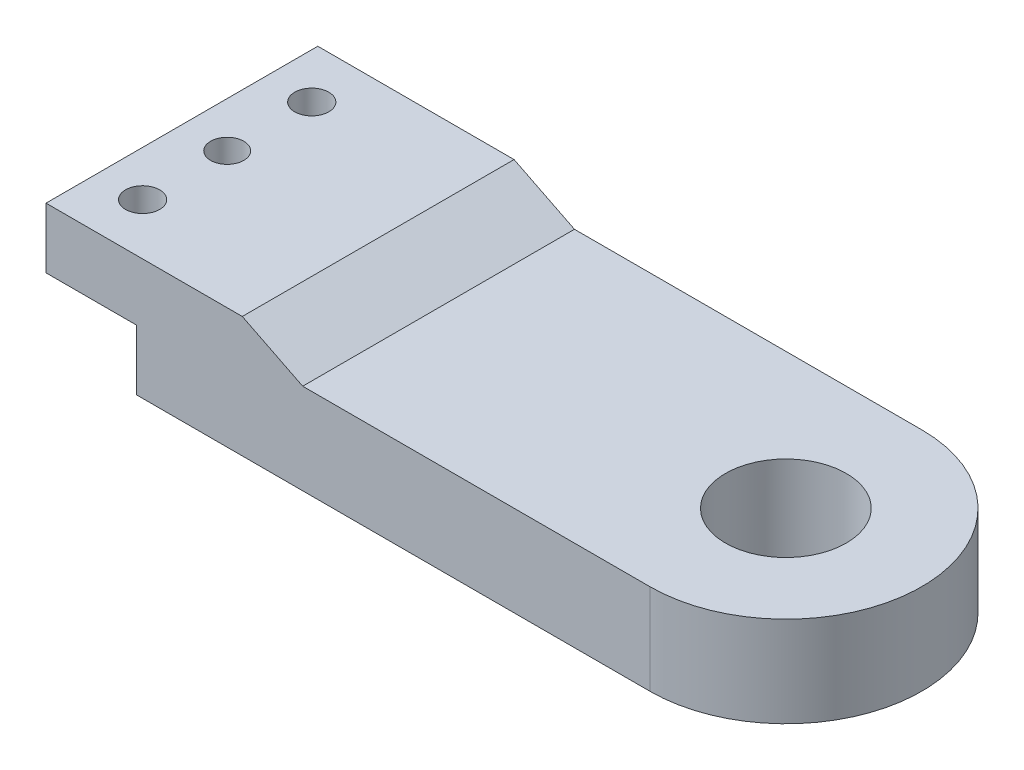
from build123d import *

# Parameters (mm, degrees)
EXTRUDE_1_DEPTH     = 20
CUT_EXTRUDE_1_REACH = 113.467
SKETCH_2_W          = 15
SKETCH_2_H          = 10
CUT_EXTRUDE_2_REACH = 104.987
SKETCH_3_R          = 2.75
SKETCH_3_R_2        = 2.824113924
CUT_EXTRUDE_3_REACH = 106.433
SKETCH_4_R          = 10
CUT_EXTRUDE_4_REACH = 113.467


with BuildPart() as part:
    # 草图1 → 凸台-拉伸1 (new body)
    with BuildSketch(Plane(origin=(0, 0, 0), x_dir=(1, 0, 0), z_dir=(0, 1, 0))):
        with BuildLine():
            Line((0, 22.5), (-100, 22.5))
            Line((-100, 22.5), (-100, -22.5))
            Line((-100, -22.5), (0, -22.5))
            ThreePointArc((0, -22.5), (22.5, 0), (0, 22.5))
        make_face()
    extrude(amount=EXTRUDE_1_DEPTH)

    # 草图2 → 切除-拉伸1 (cut, up to next)
    with BuildSketch(Plane.XY.offset(22.5), mode=Mode.PRIVATE) as cut_extrude_1_sk1:
        with Locations((-92.5, 5)):
            Rectangle(SKETCH_2_W, SKETCH_2_H)
    cut_extrude_1_tool1 = extrude(cut_extrude_1_sk1.sketch, amount=-CUT_EXTRUDE_1_REACH, mode=Mode.PRIVATE) & part.part
    add(cut_extrude_1_tool1.solids().sort_by_distance((-92.5, 5, 22.5))[0], mode=Mode.SUBTRACT)

    # 草图3 → 切除-拉伸2 (cut, up to next)
    with BuildSketch(Plane.XZ.offset(-10), mode=Mode.PRIVATE) as cut_extrude_2_sk1:
        with Locations(Location((-92.5, 0, 0), (0, 0, 270))):
            Circle(SKETCH_3_R)
    cut_extrude_2_tool1 = extrude(cut_extrude_2_sk1.sketch, amount=-CUT_EXTRUDE_2_REACH, mode=Mode.PRIVATE) & part.part
    # 草图3 → 切除-拉伸2 (cut, up to next)
    with BuildSketch(Plane.XZ.offset(-10), mode=Mode.PRIVATE) as cut_extrude_2_sk2:
        with Locations(Location((-92.5, 14, 0), (0, 0, 270))):
            Circle(SKETCH_3_R_2)
    cut_extrude_2_tool2 = extrude(cut_extrude_2_sk2.sketch, amount=-CUT_EXTRUDE_2_REACH, mode=Mode.PRIVATE) & part.part
    # 草图3 → 切除-拉伸2 (cut, up to next)
    with BuildSketch(Plane.XZ.offset(-10), mode=Mode.PRIVATE) as cut_extrude_2_sk3:
        with Locations(Location((-92.5, -14, 0), (0, 0, 270))):
            Circle(SKETCH_3_R_2)
    cut_extrude_2_tool3 = extrude(cut_extrude_2_sk3.sketch, amount=-CUT_EXTRUDE_2_REACH, mode=Mode.PRIVATE) & part.part
    add(cut_extrude_2_tool1.solids().sort_by_distance((-92.5, 10, 0))[0], mode=Mode.SUBTRACT)
    add(cut_extrude_2_tool2.solids().sort_by_distance((-92.5, 10, 14))[0], mode=Mode.SUBTRACT)
    add(cut_extrude_2_tool3.solids().sort_by_distance((-92.5, 10, -14))[0], mode=Mode.SUBTRACT)

    # 草图4 → 切除-拉伸3 (cut, up to next)
    with BuildSketch(Plane(origin=(0, 0, 0), x_dir=(1, 0, 0), z_dir=(0, 1, 0)), mode=Mode.PRIVATE) as cut_extrude_3_sk1:
        with Locations(Location((0, 0, 0), (0, 0, 90))):
            Circle(SKETCH_4_R)
    cut_extrude_3_tool1 = extrude(cut_extrude_3_sk1.sketch, amount=CUT_EXTRUDE_3_REACH, mode=Mode.PRIVATE) & part.part
    add(cut_extrude_3_tool1.solids().sort_by_distance((0, 0, 0))[0], mode=Mode.SUBTRACT)

    # 草图5 → 切除-拉伸4 (cut, up to next)
    with BuildSketch(Plane.XY.offset(22.5), mode=Mode.PRIVATE) as cut_extrude_4_sk1:
        Polygon((22.5, 20), (22.5, 15), (-57.5, 15), (-67.5, 20), align=None)
    cut_extrude_4_tool1 = extrude(cut_extrude_4_sk1.sketch, amount=-CUT_EXTRUDE_4_REACH, mode=Mode.PRIVATE) & part.part
    add(cut_extrude_4_tool1.solids().sort_by_distance((-20.04902, 17.54902, 22.5))[0], mode=Mode.SUBTRACT)


solid = part.part
